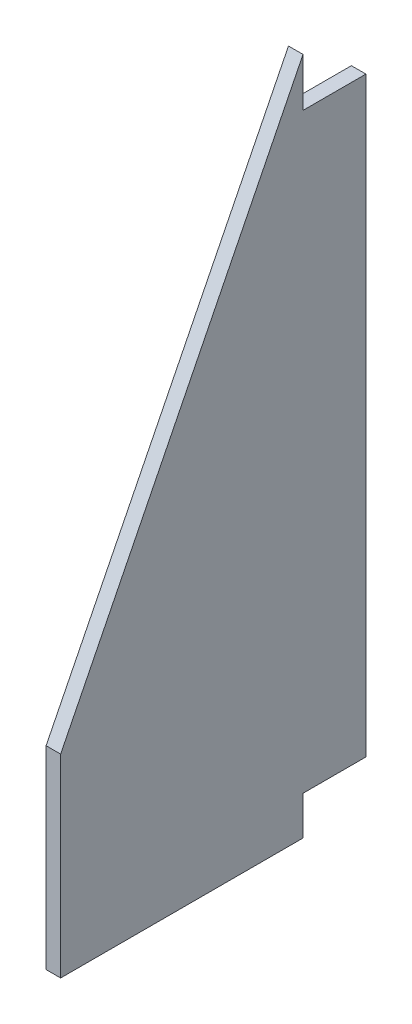
from build123d import *

# Parameters (mm, degrees)
BOSS_EXTRUDE1_DEPTH = 1.5


with BuildPart() as part:
    # Sketch1 → Boss-Extrude1 (new, symmetric)
    with BuildSketch(Plane(origin=(0, 0, 0), x_dir=(0, 0, -1), z_dir=(1, 0, 0))):
        Polygon((-33.9725, 0), (-83.9725, 0), (-83.9725, 40), (-33.9725, 140), (-33.9725, 130), (-21, 130), (-21, 8), (-33.9725, 8), align=None)
    extrude(amount=BOSS_EXTRUDE1_DEPTH, both=True)


solid = part.part
